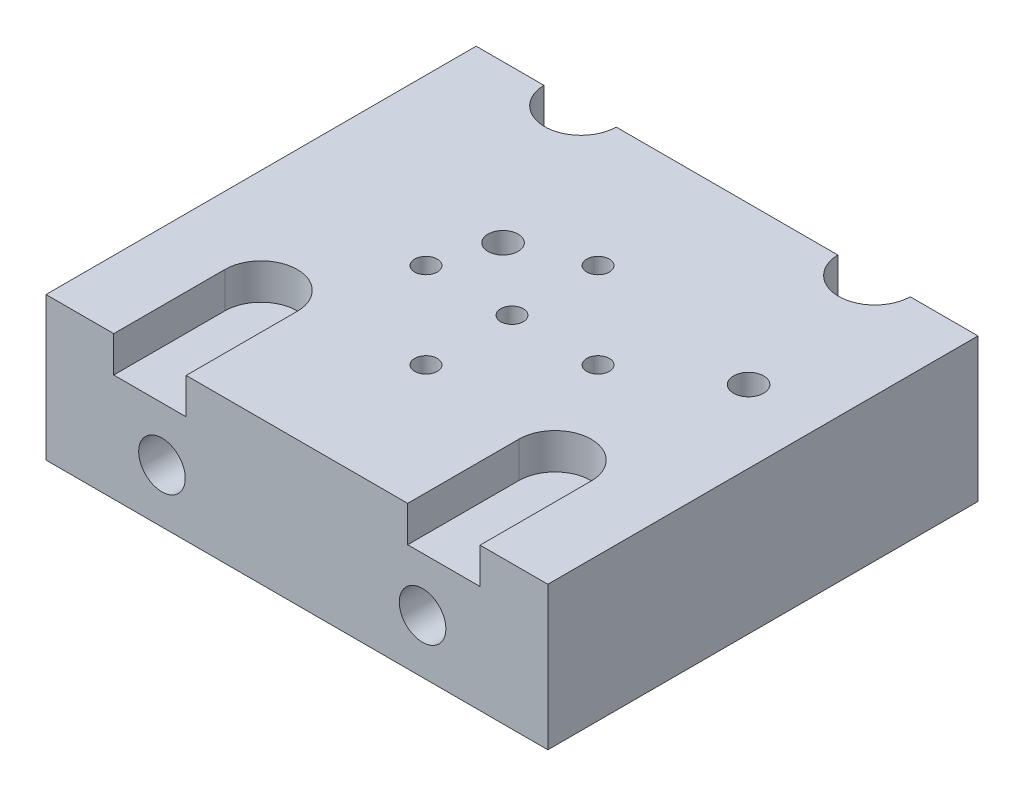
from build123d import *

# Parameters (mm, degrees)
SKETCH3_W           = 70
SKETCH3_H           = 60
BOSS_EXTRUDE3_DEPTH = 20
SKETCH4_R           = 1.575
CUT_EXTRUDE1_DEPTH  = 95.339811321
SKETCH6_R           = 2.1
CUT_EXTRUDE2_DEPTH  = 95.339811321
SKETCH9_R           = 3.25
CUT_EXTRUDE3_DEPTH  = 95.339811321
CUT_EXTRUDE4_START  = -3
SKETCH11_R          = 3
SKETCH11_R_2        = 1.575
CUT_EXTRUDE4_DEPTH  = 3
CHAMFER1_SIZE       = 0.8
SKETCH12_R          = 5.05
CUT_EXTRUDE5_DEPTH  = 5


with BuildPart() as part:
    # Sketch3 → Boss-Extrude3 (new body)
    with BuildSketch(Plane(origin=(0, 0, 0), x_dir=(1, 0, 0), z_dir=(0, 1, 0))):
        with Locations((35, -30)):
            Rectangle(SKETCH3_W, SKETCH3_H)
    extrude(amount=BOSS_EXTRUDE3_DEPTH)

    # Sketch4 → Cut-Extrude1 (cut, through all)
    with BuildSketch(Plane(origin=(0, 20, 0), x_dir=(1, 0, 0), z_dir=(0, 1, 0))):
        with Locations(Location((35, -30, 0), (0, 0, 270))):
            Circle(SKETCH4_R)
        with Locations(Location((35, -18, 0), (0, 0, 270))):
            Circle(SKETCH4_R)
        with Locations(Location((47, -30, 0), (0, 0, 270))):
            Circle(SKETCH4_R)
        with Locations(Location((35, -42, 0), (0, 0, 270))):
            Circle(SKETCH4_R)
        with Locations(Location((23, -30, 0), (0, 0, 270))):
            Circle(SKETCH4_R)
    extrude(amount=-CUT_EXTRUDE1_DEPTH, mode=Mode.SUBTRACT)

    # Sketch6 → Cut-Extrude2 (cut, through all)
    with BuildSketch(Plane.XZ):
        with Locations(Location((59.875, 21.875, 0), (0, 0, 270))):
            Circle(SKETCH6_R)
        with Locations(Location((25.625, 21.875, 0), (0, 0, 270))):
            Circle(SKETCH6_R)
    extrude(amount=-CUT_EXTRUDE2_DEPTH, mode=Mode.SUBTRACT)

    # Sketch9 → Cut-Extrude3 (cut, through all)
    with BuildSketch(Plane(origin=(0, 0, 0), x_dir=(-1, 0, 0), z_dir=(0, 0, -1))):
        with Locations((-52.525, 7.5)):
            Circle(SKETCH9_R)
        with Locations((-16.175, 7.5)):
            Circle(SKETCH9_R)
    extrude(amount=-CUT_EXTRUDE3_DEPTH, mode=Mode.SUBTRACT)

    # Sketch11 → Cut-Extrude4 (cut)
    # profile 1 of 10: a face of its own
    with BuildSketch(Plane.XZ.offset(CUT_EXTRUDE4_START)):
        with Locations(Location((35, 18, 0), (0, 0, 270))):
            Circle(SKETCH11_R)
        with Locations(Location((35, 18, 0), (0, 0, 90))):
            Circle(SKETCH11_R_2, mode=Mode.SUBTRACT)
    # profile 2 of 10: a face of its own
    with BuildSketch(Plane.XZ.offset(CUT_EXTRUDE4_START)):
        with Locations(Location((35, 30, 0), (0, 0, 270))):
            Circle(SKETCH11_R)
        with Locations(Location((35, 30, 0), (0, 0, 90))):
            Circle(SKETCH11_R_2, mode=Mode.SUBTRACT)
    # profile 3 of 10: a face of its own
    with BuildSketch(Plane.XZ.offset(CUT_EXTRUDE4_START)):
        with Locations(Location((47, 30, 0), (0, 0, 270))):
            Circle(SKETCH11_R)
        with Locations(Location((47, 30, 0), (0, 0, 90))):
            Circle(SKETCH11_R_2, mode=Mode.SUBTRACT)
    # profile 4 of 10: a face of its own
    with BuildSketch(Plane.XZ.offset(CUT_EXTRUDE4_START)):
        with Locations(Location((23, 30, 0), (0, 0, 270))):
            Circle(SKETCH11_R)
        with Locations(Location((23, 30, 0), (0, 0, 90))):
            Circle(SKETCH11_R_2, mode=Mode.SUBTRACT)
    # profile 5 of 10: a face of its own
    with BuildSketch(Plane.XZ.offset(CUT_EXTRUDE4_START)):
        with Locations(Location((35, 42, 0), (0, 0, 270))):
            Circle(SKETCH11_R)
        with Locations(Location((35, 42, 0), (0, 0, 90))):
            Circle(SKETCH11_R_2, mode=Mode.SUBTRACT)
    # profile 6 of 10: a face of its own
    with BuildSketch(Plane.XZ.offset(CUT_EXTRUDE4_START)):
        with Locations(Location((35, 42, 0), (0, 0, 90))):
            Circle(SKETCH11_R_2)
    # profile 7 of 10: a face of its own
    with BuildSketch(Plane.XZ.offset(CUT_EXTRUDE4_START)):
        with Locations(Location((23, 30, 0), (0, 0, 90))):
            Circle(SKETCH11_R_2)
    # profile 8 of 10: a face of its own
    with BuildSketch(Plane.XZ.offset(CUT_EXTRUDE4_START)):
        with Locations(Location((35, 30, 0), (0, 0, 90))):
            Circle(SKETCH11_R_2)
    # profile 9 of 10: a face of its own
    with BuildSketch(Plane.XZ.offset(CUT_EXTRUDE4_START)):
        with Locations(Location((47, 30, 0), (0, 0, 90))):
            Circle(SKETCH11_R_2)
    # profile 10 of 10: a face of its own
    with BuildSketch(Plane.XZ.offset(CUT_EXTRUDE4_START)):
        with Locations(Location((35, 18, 0), (0, 0, 90))):
            Circle(SKETCH11_R_2)
    extrude(amount=CUT_EXTRUDE4_DEPTH, mode=Mode.SUBTRACT)

    # Chamfer1
    chamfer1_edges = [part.edges().sort_by_distance(p)[0] for p in [
        (55.775, 7.5, 0),
        (19.425, 7.5, 0),
    ]]
    chamfer(chamfer1_edges, length=CHAMFER1_SIZE)

    # Sketch12 → Cut-Extrude5 (cut)
    with BuildSketch(Plane(origin=(0, 20, 0), x_dir=(1, 0, 0), z_dir=(0, 1, 0))):
        with Locations((14.5, 0.104949747)):
            Circle(SKETCH12_R)
        with Locations((55.5, 0.104949747)):
            Circle(SKETCH12_R)
        with BuildLine():
            Line((9.45, -60.104949747), (9.45, -44.5))
            ThreePointArc((9.45, -44.5), (14.5, -39.45), (19.55, -44.5))
            Line((19.55, -44.5), (19.55, -60.104949747))
            ThreePointArc((19.55, -60.104949747), (14.5, -65.154949747), (9.45, -60.104949747))
        make_face()
        with BuildLine():
            Line((60.55, -60.104949747), (60.55, -44.5))
            ThreePointArc((60.55, -44.5), (55.5, -39.45), (50.45, -44.5))
            Line((50.45, -44.5), (50.45, -60.104949747))
            ThreePointArc((50.45, -60.104949747), (55.5, -65.154949747), (60.55, -60.104949747))
        make_face()
    extrude(amount=-CUT_EXTRUDE5_DEPTH, mode=Mode.SUBTRACT)


solid = part.part
